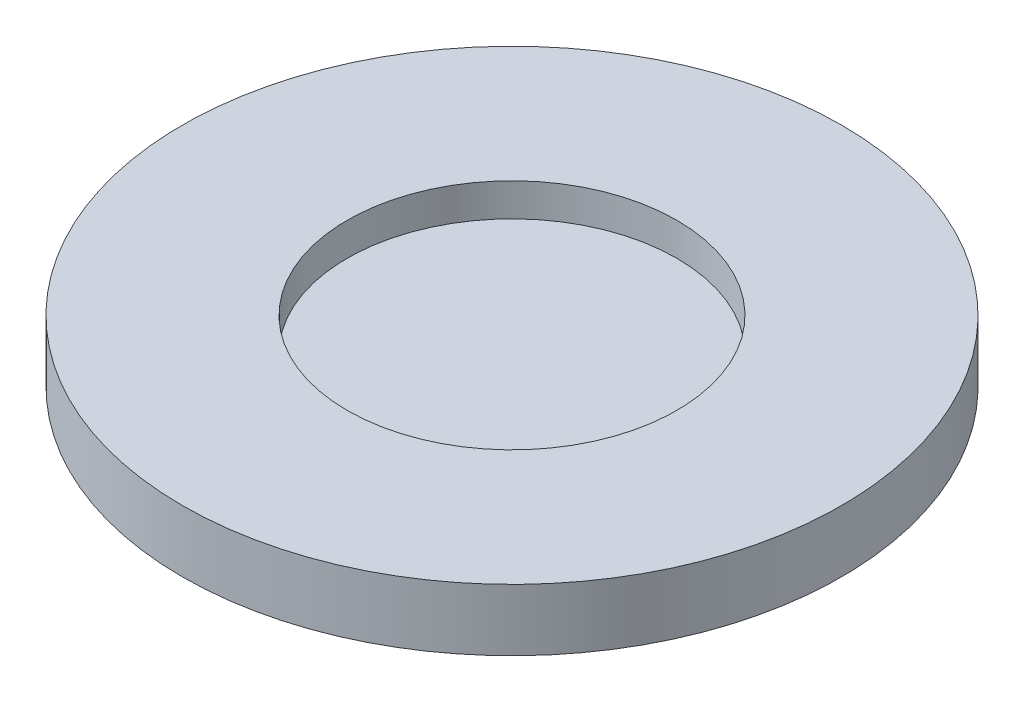
from build123d import *

# Parameters (mm, degrees)
SKETCH1_R           = 25.4
BOSS_EXTRUDE1_DEPTH = 4.7625
SKETCH2_R           = 12.7
CUT_EXTRUDE1_DEPTH  = 2.54


with BuildPart() as part:
    # Sketch1 → Boss-Extrude1 (new body)
    with BuildSketch(Plane(origin=(0, 0, 0), x_dir=(1, 0, 0), z_dir=(0, 1, 0))):
        with Locations(Location((0, 0, 0), (0, 0, 90))):
            Circle(SKETCH1_R)
    extrude(amount=BOSS_EXTRUDE1_DEPTH)

    # Sketch2 → Cut-Extrude1 (cut)
    with BuildSketch(Plane(origin=(0, 4.7625, 0), x_dir=(1, 0, 0), z_dir=(0, 1, 0))):
        with Locations(Location((0, 0, 0), (0, 0, 270))):
            Circle(SKETCH2_R)
    extrude(amount=-CUT_EXTRUDE1_DEPTH, mode=Mode.SUBTRACT)


solid = part.part
